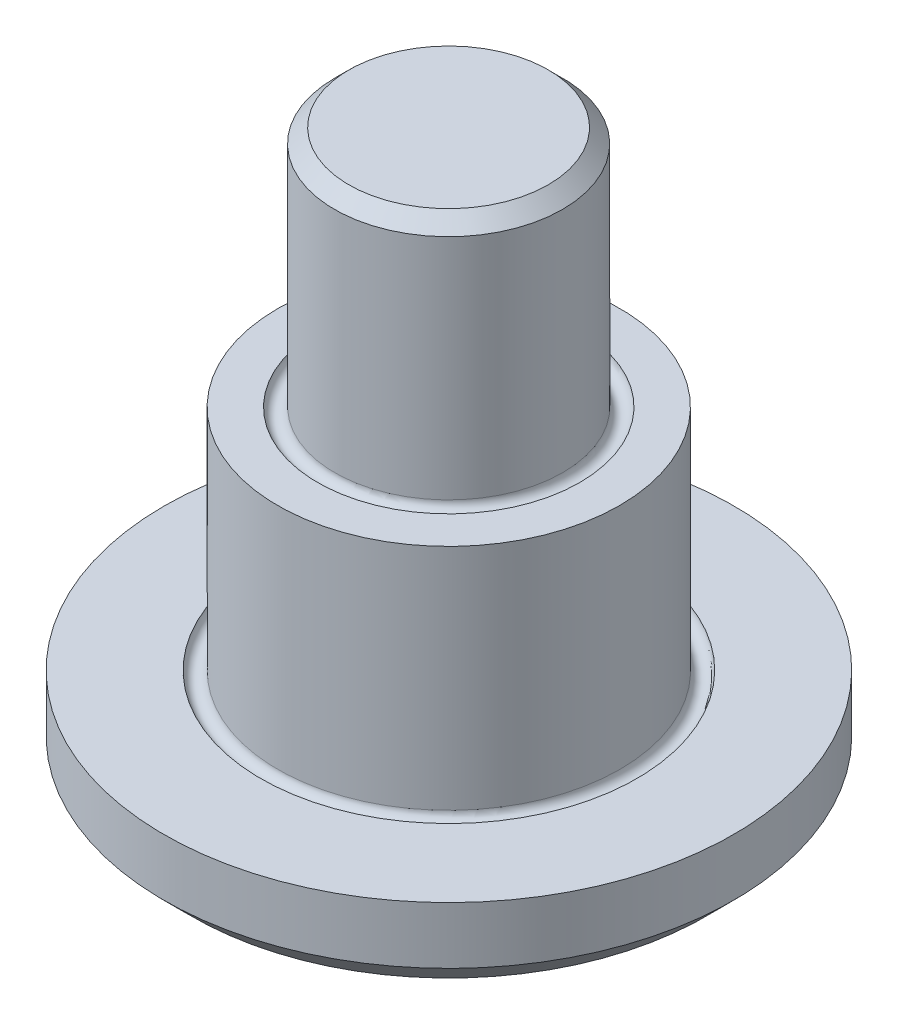
from build123d import *


with BuildPart() as part:
    # Esquisse1 → Base-Révolution (revolve)
    with BuildSketch(Plane(origin=(0, 0.031816132, 805.747002229), x_dir=(-1, 0, 0), z_dir=(0, -3.948650350493743e-05, -0.999999999220408)), mode=Mode.PRIVATE) as base_r_volution_sk:
        with BuildLine():
            Line((-2032.314000082, 595.971315329), (-2023.31328189, 595.964822989))
            Line((-2023.31328189, 595.964822989), (-2023.299216279, 615.464817916))
            Line((-2023.299216279, 615.464817916), (-2026.799575635, 615.467342773))
            Line((-2026.799575635, 615.467342773), (-2027.299575635, 614.968063566))
            Line((-2027.299575635, 614.968063566), (-2027.305346123, 606.968092429))
            ThreePointArc((-2027.305346123, 606.968092429), (-2027.605368915, 606.668308824), (-2027.905345996, 606.968138169))
            Line((-2027.905345996, 606.968138169), (-2029.305345882, 606.969148008))
            Line((-2029.305345882, 606.969148008), (-2029.311131642, 598.94800312))
            ThreePointArc((-2029.311131642, 598.94800312), (-2029.62117852, 598.669386557), (-2029.910382155, 598.969582347))
            Line((-2029.910382155, 598.969582347), (-2033.311115348, 598.972035342))
            Line((-2033.311115348, 598.972035342), (-2033.312558495, 596.971315329))
            Line((-2033.312558495, 596.971315329), (-2032.314000082, 595.971315329))
        make_face()
    revolve(base_r_volution_sk.sketch.rotate(Axis((2023.313282323, 595.996038449, 805.723469686), (-0.0007213133811924766, 0.9999997390738775, -3.948649323018317e-05)), 179.999998368), axis=Axis((2023.313282323, 595.996038449, 805.723469686), (-0.0007213133811924766, 0.9999997390738775, -3.948649323018317e-05)))


solid = part.part
